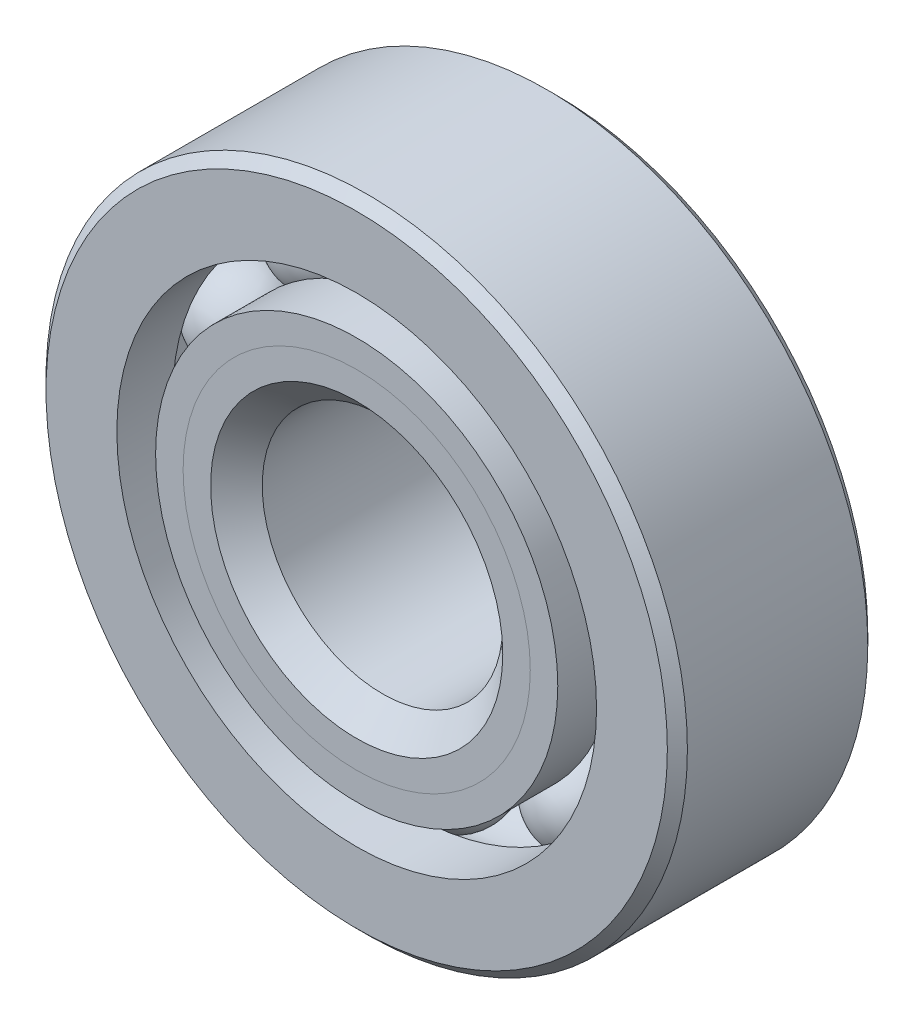
from build123d import *

# Parameters (mm, degrees)
CIRPATTERN1_COUNT = 10


with BuildPart() as part:
    # Sketch1 → Revolve1 (revolve)
    with BuildSketch(Plane(origin=(0, 0, 0), x_dir=(0, 0, -1), z_dir=(1, 0, 0)), mode=Mode.PRIVATE) as revolve1_sk:
        with BuildLine():
            Line((1.7859375, 6.35), (-1.7859375, 6.35))
            Line((-1.7859375, 6.35), (-1.984375, 6.1515625))
            Line((-1.984375, 6.1515625), (-1.984375, 4.749416209))
            Line((-1.984375, 4.749416209), (-0.881944444, 4.749416209))
            ThreePointArc((-0.881944444, 4.749416209), (0, 5.327457467), (0.881944444, 4.749416209))
            Line((0.881944444, 4.749416209), (1.984375, 4.749416209))
            Line((1.984375, 4.749416209), (1.984375, 6.1515625))
            Line((1.984375, 6.1515625), (1.7859375, 6.35))
        make_face()
    revolve(revolve1_sk.sketch.rotate(Axis((0, 0, 1.984375), (0, 0, -1)), 90), axis=Axis((0, 0, 1.984375), (0, 0, -1)))


with BuildPart() as body_2:
    # Sketch2 → Revolve2 (revolve)
    with BuildSketch(Plane(origin=(0, 0, 0), x_dir=(0, 0, -1), z_dir=(1, 0, 0)), mode=Mode.PRIVATE) as revolve2_sk:
        with BuildLine():
            Line((-1.984375, 3.981833791), (-0.881944444, 3.981833791))
            ThreePointArc((-0.881944444, 3.981833791), (-0.527247025, 3.561179682), (0, 3.403792533))
            Line((0, 3.403792533), (0, 2.892521266))
            Line((0, 2.892521266), (-1.439718738, 2.892521266))
            Line((-1.439718738, 2.892521266), (-1.984375, 3.437177529))
            Line((-1.984375, 3.437177529), (-1.984375, 3.981833791))
        make_face()
    revolve(revolve2_sk.sketch.rotate(Axis((0, 0, 1.984375), (0, 0, -1)), 90), axis=Axis((0, 0, 1.984375), (0, 0, -1)))


with BuildPart() as body_3:
    # Sketch3 → Revolve3 (revolve)
    with BuildSketch(Plane(origin=(0, 0, 0), x_dir=(0, 0, -1), z_dir=(1, 0, 0)), mode=Mode.PRIVATE) as revolve3_sk:
        with BuildLine():
            Line((-1.984375, 3.437177529), (-1.439718738, 2.892521266))
            Line((-1.439718738, 2.892521266), (0, 2.892521266))
            Line((0, 2.892521266), (0, 3.403792533))
            ThreePointArc((0, 3.403792533), (0.527247025, 3.561179682), (0.881944444, 3.981833791))
            Line((0.881944444, 3.981833791), (1.984375, 3.981833791))
            Line((1.984375, 3.981833791), (1.984375, 2.5796875))
            Line((1.984375, 2.5796875), (1.7859375, 2.38125))
            Line((1.7859375, 2.38125), (-1.473103734, 2.38125))
            Line((-1.473103734, 2.38125), (-1.984375, 2.892521266))
            Line((-1.984375, 2.892521266), (-1.984375, 3.437177529))
        make_face()
    revolve(revolve3_sk.sketch.rotate(Axis((0, 0, 1.984375), (0, 0, -1)), 90), axis=Axis((0, 0, 1.984375), (0, 0, -1)))


with BuildPart() as body_4:
    # Sketch4 → Revolve4 (revolve)
    with BuildSketch(Plane(origin=(0, 0, 0), x_dir=(0, 0, -1), z_dir=(1, 0, 0))):
        with BuildLine():
            Line((-0.961832467, 4.365625), (0.961832467, 4.365625))
            ThreePointArc((0.961832467, 4.365625), (0, 5.327457467), (-0.961832467, 4.365625))
        make_face()
    revolve(axis=Axis((0, 4.365625, 0.961832467), (0, 0, -1)))


with BuildPart() as cirpattern1_1:
    # CirPattern1: pattern copy
    add(body_4.part.rotate(Axis((0, 0, 0), (0, 0, 1)), 1 * 360 / CIRPATTERN1_COUNT))


with BuildPart() as cirpattern1_2:
    # CirPattern1: pattern copy
    add(body_4.part.rotate(Axis((0, 0, 0), (0, 0, 1)), 2 * 360 / CIRPATTERN1_COUNT))


with BuildPart() as cirpattern1_3:
    # CirPattern1: pattern copy
    add(body_4.part.rotate(Axis((0, 0, 0), (0, 0, 1)), 3 * 360 / CIRPATTERN1_COUNT))


with BuildPart() as cirpattern1_4:
    # CirPattern1: pattern copy
    add(body_4.part.rotate(Axis((0, 0, 0), (0, 0, 1)), 4 * 360 / CIRPATTERN1_COUNT))


with BuildPart() as cirpattern1_5:
    # CirPattern1: pattern copy
    add(body_4.part.rotate(Axis((0, 0, 0), (0, 0, 1)), 5 * 360 / CIRPATTERN1_COUNT))


with BuildPart() as cirpattern1_6:
    # CirPattern1: pattern copy
    add(body_4.part.rotate(Axis((0, 0, 0), (0, 0, 1)), 6 * 360 / CIRPATTERN1_COUNT))


with BuildPart() as cirpattern1_7:
    # CirPattern1: pattern copy
    add(body_4.part.rotate(Axis((0, 0, 0), (0, 0, 1)), 7 * 360 / CIRPATTERN1_COUNT))


with BuildPart() as cirpattern1_8:
    # CirPattern1: pattern copy
    add(body_4.part.rotate(Axis((0, 0, 0), (0, 0, 1)), 8 * 360 / CIRPATTERN1_COUNT))


with BuildPart() as cirpattern1_9:
    # CirPattern1: pattern copy
    add(body_4.part.rotate(Axis((0, 0, 0), (0, 0, 1)), 9 * 360 / CIRPATTERN1_COUNT))


solid = Compound([part.part, body_2.part, body_3.part, body_4.part, cirpattern1_1.part, cirpattern1_2.part, cirpattern1_3.part, cirpattern1_4.part, cirpattern1_5.part, cirpattern1_6.part, cirpattern1_7.part, cirpattern1_8.part, cirpattern1_9.part])
